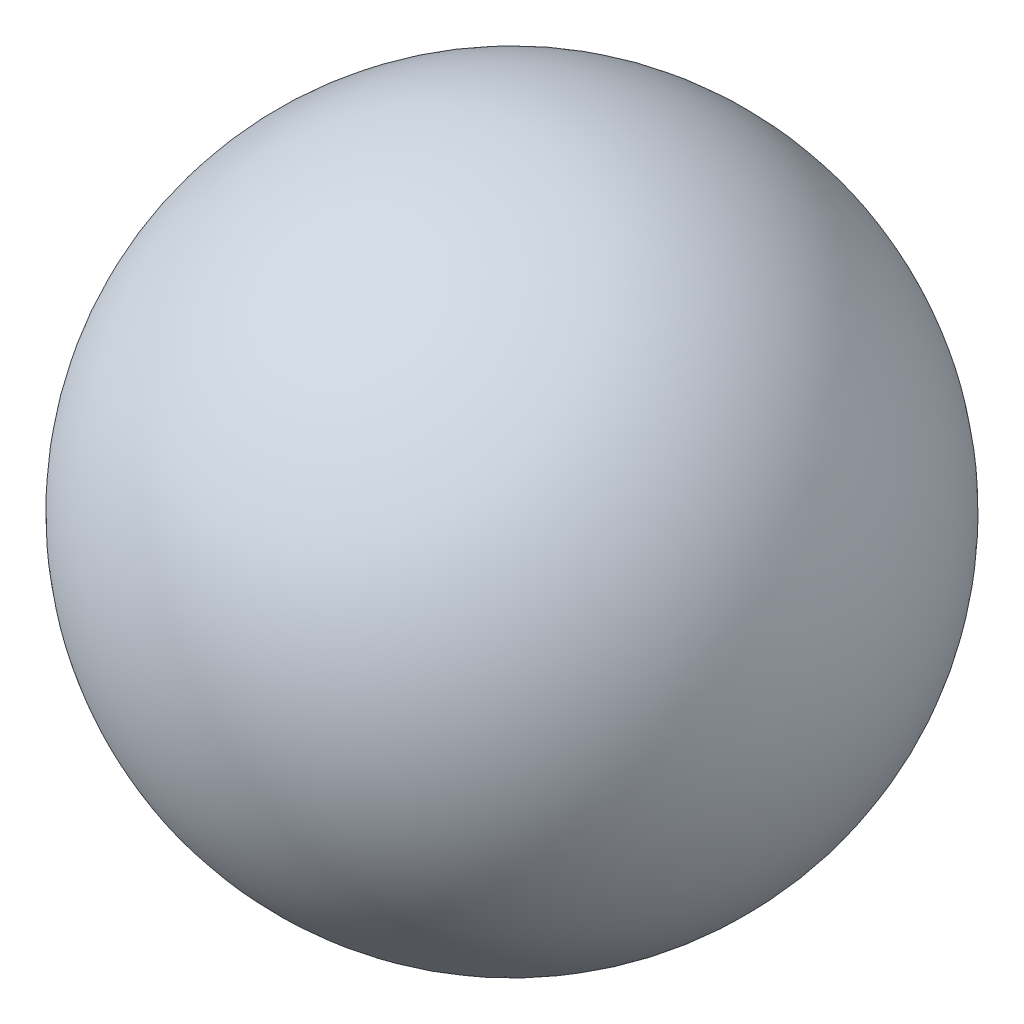
from build123d import *


with BuildPart() as part:
    # 草圖1 → 旋轉1 (revolve)
    with BuildSketch(Plane(origin=(0, 0, 0), x_dir=(1, 0, 0), z_dir=(0, 1, 0))):
        with BuildLine():
            Line((0, 30), (0, -30))
            ThreePointArc((0, -30), (30, 0), (0, 30))
        make_face()
    revolve(axis=Axis((0, 0, -30), (0, 0, 1)))


solid = part.part
